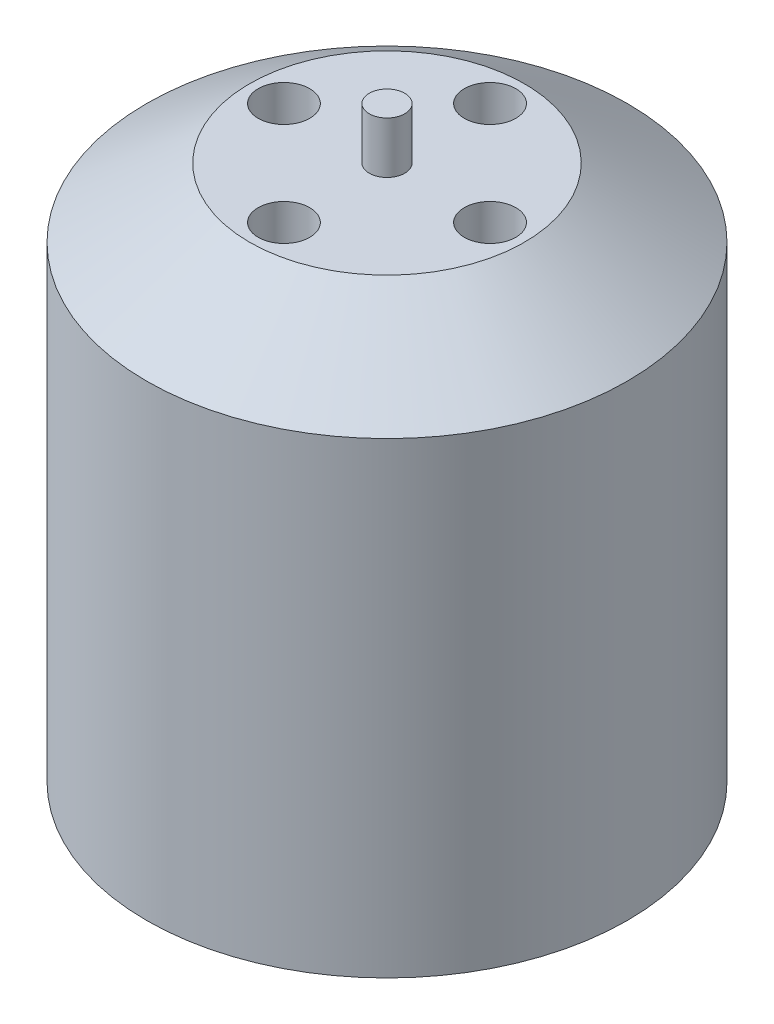
from build123d import *

# Parameters (mm, degrees)
SKIZZE1_R                       = 14
AUFSATZ_LINEAR_AUSTRAGEN1_DEPTH = 31.2
FASE1_SIZE                      = 4
FASE1_SIZE2                     = 6
SKIZZE2_R                       = 1.033731655
AUFSATZ_LINEAR_AUSTRAGEN2_DEPTH = 3
SKIZZE3_R                       = 1.5
SCHNITT_LINEAR_AUSTRAGEN1_DEPTH = 3
SKIZZE4_R                       = 3.1
AUFSATZ_LINEAR_AUSTRAGEN3_DEPTH = 3
SKIZZE5_R                       = 1.5
SCHNITT_LINEAR_AUSTRAGEN2_DEPTH = 3


with BuildPart() as part:
    # Skizze1 → Aufsatz-Linear austragen1 (new body)
    with BuildSketch(Plane(origin=(0, 0, 0), x_dir=(1, 0, 0), z_dir=(0, 1, 0))):
        with Locations(Location((0, 0, 0), (0, 0, 270))):
            Circle(SKIZZE1_R)
    extrude(amount=AUFSATZ_LINEAR_AUSTRAGEN1_DEPTH)

    # Fase1
    fase1_edges = [part.edges().sort_by_distance(p)[0] for p in [
        (0, 31.2, -14),
    ]]
    fase1_side = [part.faces().sort_by_distance(p)[0] for p in [
        (0, 15.6, -14),
    ]]
    chamfer(fase1_edges, length=FASE1_SIZE, length2=FASE1_SIZE2, reference=fase1_side[0])

    # Skizze2 → Aufsatz-Linear austragen2 (add)
    with BuildSketch(Plane(origin=(0, 31.2, 0), x_dir=(1, 0, 0), z_dir=(0, 1, 0))):
        with Locations(Location((0, 0, 0), (0, 0, 270))):
            Circle(SKIZZE2_R)
    extrude(amount=AUFSATZ_LINEAR_AUSTRAGEN2_DEPTH)

    # Skizze3 → Schnitt-Linear austragen1 (cut)
    with BuildSketch(Plane(origin=(0, 31.2, 0), x_dir=(1, 0, 0), z_dir=(0, 1, 0))):
        with Locations(Location((-6, 0, 0), (0, 0, 270))):
            Circle(SKIZZE3_R)
        with Locations(Location((0, 6, 0), (0, 0, 270))):
            Circle(SKIZZE3_R)
        with Locations(Location((6, 0, 0), (0, 0, 270))):
            Circle(SKIZZE3_R)
        with Locations(Location((0, -6, 0), (0, 0, 270))):
            Circle(SKIZZE3_R)
    extrude(amount=-SCHNITT_LINEAR_AUSTRAGEN1_DEPTH, mode=Mode.SUBTRACT)

    # Skizze4 → Aufsatz-Linear austragen3 (add)
    with BuildSketch(Plane.XZ):
        with Locations(Location((0, 0, 0), (0, 0, 270))):
            Circle(SKIZZE4_R)
    extrude(amount=AUFSATZ_LINEAR_AUSTRAGEN3_DEPTH)

    # Skizze5 → Schnitt-Linear austragen2 (cut)
    with BuildSketch(Plane.XZ):
        with Locations(Location((0, 8, 0), (0, 0, 270))):
            Circle(SKIZZE5_R)
        with Locations(Location((-9.5, 0, 0), (0, 0, 270))):
            Circle(SKIZZE5_R)
        with Locations(Location((9.5, 0, 0), (0, 0, 270))):
            Circle(SKIZZE5_R)
        with Locations(Location((0, -8, 0), (0, 0, 270))):
            Circle(SKIZZE5_R)
    extrude(amount=-SCHNITT_LINEAR_AUSTRAGEN2_DEPTH, mode=Mode.SUBTRACT)


solid = part.part
